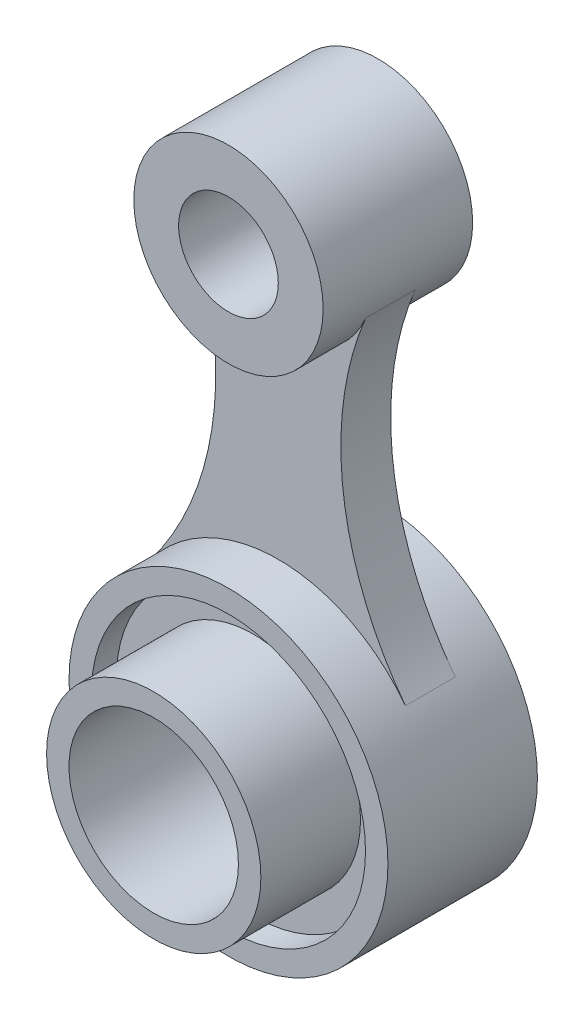
from build123d import *
from build123d.topology import SkipClean

# Parameters (mm, degrees)
SKETCH2_R                = 27.5
SKETCH2_R_2              = 21.5
CUT_EXTRUDE1_DEPTH       = 5
BOSS_EXTRUDE1_DEPTH      = 15
BOSS_EXTRUDE1_DEPTH_BACK = 15
SKETCH3_R                = 19
SKETCH3_R_2              = 10
BOSS_EXTRUDE2_DEPTH      = 5
BOSS_EXTRUDE2_DEPTH_BACK = 5


with BuildPart() as part:
    # Sketch1 → Revolve1 (revolve)
    with BuildSketch(Plane(origin=(0, 0, 0), x_dir=(0, 0, -1), z_dir=(1, 0, 0))):
        Polygon((0, 17), (45, 17), (45, 32), (15, 32), (15, 21.5), (0, 21.5), align=None)
    revolve(axis=Axis((0, 0, 0), (0, 0, -1)))

    # Sketch2 → Cut-Extrude1 (cut)
    with SkipClean():  # the faces are left unmerged after this step: merging them gives an invalid solid
        with BuildSketch(Plane.XY.offset(-15)):
            Circle(SKETCH2_R)
            Circle(SKETCH2_R_2, mode=Mode.SUBTRACT)
        extrude(amount=-CUT_EXTRUDE1_DEPTH, mode=Mode.SUBTRACT)



with BuildPart() as body_2:
    # Sketch3 → Boss-Extrude1 (new, two sides: drawn at the far end of the back side and taken through both)
    with BuildSketch(Plane.XY.offset(-30).offset(-BOSS_EXTRUDE1_DEPTH_BACK)):
        with Locations((0, 90)):
            Circle(SKETCH3_R)
        with Locations((0, 90)):
            Circle(SKETCH3_R_2, mode=Mode.SUBTRACT)
    extrude(amount=BOSS_EXTRUDE1_DEPTH + BOSS_EXTRUDE1_DEPTH_BACK)


with BuildPart() as part_1:
    with SkipClean():  # the faces are left unmerged after this step: merging them gives an invalid solid
        add(part.part)

        add(body_2.part)  # Boss-Extrude2 merges body 2
        # Sketch4 → Boss-Extrude2 (add, two sides: drawn at the far end of the back side and taken through both)
        with BuildSketch(Plane.XY.offset(-30).offset(-BOSS_EXTRUDE2_DEPTH_BACK)):
            with BuildLine():
                ThreePointArc((25.517690077, 19.309259259), (0, 32), (-25.517690077, 19.309259259))
                ThreePointArc((-25.517690077, 19.309259259), (-13.056566583, 49.915660424), (-17.5241968, 82.658165997))
                ThreePointArc((-17.5241968, 82.658165997), (0, 71), (17.5241968, 82.658165997))
                ThreePointArc((17.5241968, 82.658165997), (13.056566583, 49.915660424), (25.517690077, 19.309259259))
            make_face()
        extrude(amount=BOSS_EXTRUDE2_DEPTH + BOSS_EXTRUDE2_DEPTH_BACK)


solid = part_1.part
